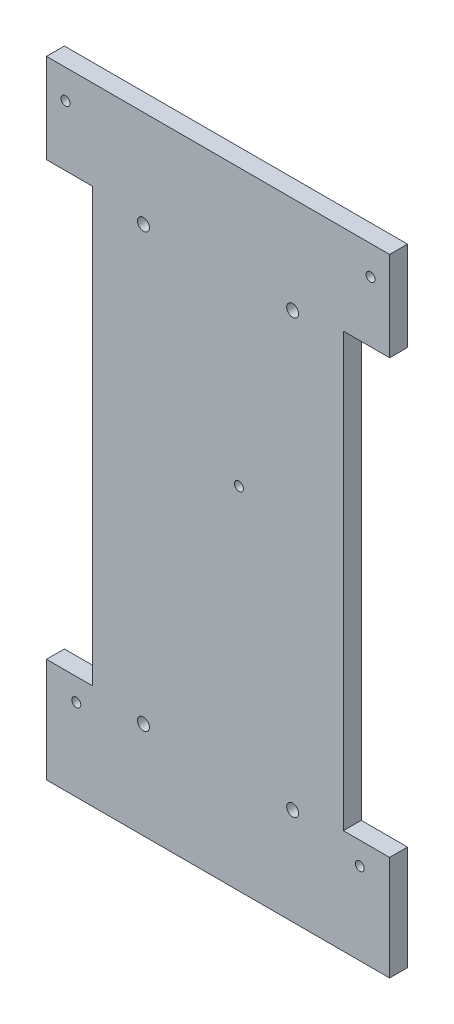
from build123d import *

# Parameters (mm, degrees)
SKETCH_1_R      = 1.5
SKETCH_1_R_2    = 2
EXTRUDE_1_DEPTH = 6


with BuildPart() as part:
    # Эскиз1 → Бобышка-Вытянуть1 (new body)
    with BuildSketch(Plane.XY):
        Polygon((-48.7844548, 129.437494331), (-57.5, 129.437494331), (-57.5, 112.022171177), (-57.5, 99.437494331), (-41.992637301, 99.437494331), (-41.992637301, -45.562505669), (-57.5, -45.562505669), (-57.5, -52.165920458), (-57.5, -53.062505669), (-57.5, -80.562505669), (-47.5, -80.562505669), (-25, -80.562505669), (7, -80.562505669), (57.5, -80.562505669), (57.5, -45.562505669), (41.992637301, -45.562505669), (41.992637301, 99.437494331), (57.5, 99.437494331), (57.5, 129.437494331), (-25.341365772, 129.437494331), align=None)
        with Locations((-47.5, -53.062505669)):
            Circle(SKETCH_1_R, mode=Mode.SUBTRACT)
        with Locations((-25, -48.062505669)):
            Circle(SKETCH_1_R_2, mode=Mode.SUBTRACT)
        with Locations((25, -48.062505669)):
            Circle(SKETCH_1_R_2, mode=Mode.SUBTRACT)
        with Locations((47.5, -53.062505669)):
            Circle(SKETCH_1_R, mode=Mode.SUBTRACT)
        with Locations((-51.105648031, 119.710621144)):
            Circle(SKETCH_1_R, mode=Mode.SUBTRACT)
        with Locations((-25, 96.939287159)):
            Circle(SKETCH_1_R_2, mode=Mode.SUBTRACT)
        with Locations((7, 36.937494331)):
            Circle(SKETCH_1_R, mode=Mode.SUBTRACT)
        with Locations((25, 96.939287159)):
            Circle(SKETCH_1_R_2, mode=Mode.SUBTRACT)
        with Locations((51.105648031, 119.710621144)):
            Circle(SKETCH_1_R, mode=Mode.SUBTRACT)
    extrude(amount=EXTRUDE_1_DEPTH)


solid = part.part
